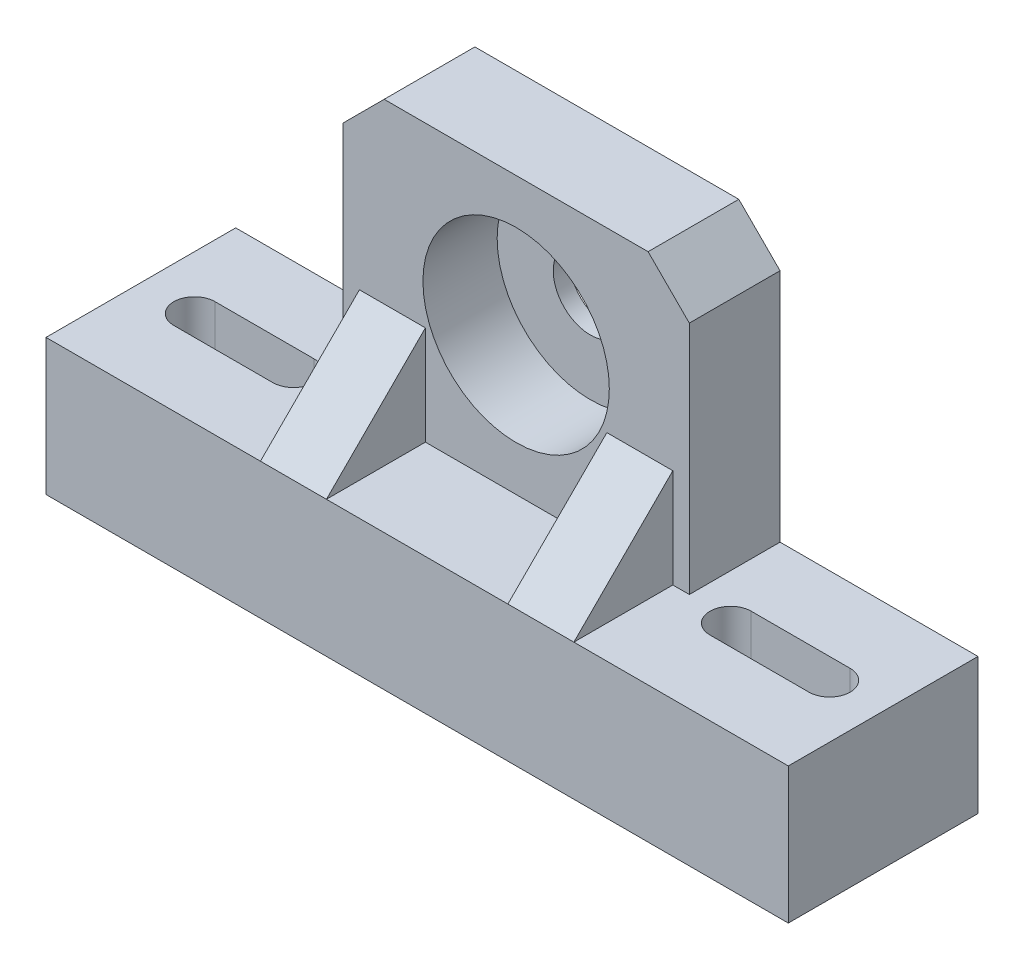
from build123d import *

# Parameters (mm, degrees)
CROQUIS1_W              = 42
CROQUIS1_H              = 33.5
SALIENTE_EXTRUIR1_DEPTH = 5.5
SALIENTE_EXTRUIR2_DEPTH = 12
NERVIO4_REACH           = 72.794
CROQUIS4_WALL_W         = 160.558874412
CROQUIS4_WALL_H         = 8
CROQUIS5_R              = 4.5
CORTAR_EXTRUIR1_DEPTH   = 12
CROQUIS6_R              = 11.3
CORTAR_EXTRUIR2_DEPTH   = 9
CORTAR_EXTRUIR3_DEPTH   = 70.507193872
CHAFL_N1_SIZE           = 5


with BuildPart() as part:
    # Croquis1 → Saliente-Extruir1 (new, symmetric)
    with BuildSketch(Plane.XY):
        Rectangle(CROQUIS1_W, CROQUIS1_H)
        Polygon((21, -16.75), (-21, -16.75), (-45, -16.75), (-45, -33.25), (45, -33.25), (45, -16.75), align=None)
    extrude(amount=SALIENTE_EXTRUIR1_DEPTH, both=True)

    # Croquis2 → Saliente-Extruir2 (add)
    with BuildSketch(Plane.XY.offset(5.5)):
        Polygon((-21, -16.75), (-45, -16.75), (-45, -33.25), (45, -33.25), (45, -16.75), (21, -16.75), align=None)
    extrude(amount=SALIENTE_EXTRUIR2_DEPTH)

    # Croquis4 wall → Nervio4 (add, up to next)
    with BuildSketch(Plane(origin=(15, -10.75, 11.5), x_dir=(0, -0.707106781187, 0.707106781187), z_dir=(0, -0.707106781187, -0.707106781187)), mode=Mode.PRIVATE) as nervio4_sk1:
        Rectangle(CROQUIS4_WALL_W, CROQUIS4_WALL_H)
    nervio4_tool1 = extrude(nervio4_sk1.sketch, amount=NERVIO4_REACH, mode=Mode.PRIVATE) - part.part
    nervio4 = nervio4_tool1.solids().sort_by_distance((15, -10.75, 11.5))[0]
    add(nervio4)

    # Simetría1: Nervio4 across plane
    add(nervio4.mirror(Plane(origin=(0, 0, 0), x_dir=(0, 0, 1), z_dir=(1, 0, 0))))

    # Croquis5 → Cortar-Extruir1 (cut)
    with BuildSketch(Plane.XY.offset(5.5)):
        Circle(CROQUIS5_R)
    extrude(amount=-CORTAR_EXTRUIR1_DEPTH, mode=Mode.SUBTRACT)

    # Croquis6 → Cortar-Extruir2 (cut)
    with BuildSketch(Plane.XY.offset(5.5)):
        Circle(CROQUIS6_R)
    extrude(amount=-CORTAR_EXTRUIR2_DEPTH, mode=Mode.SUBTRACT)

    # Croquis7 → Cortar-Extruir3 (cut, through all)
    with BuildSketch(Plane.XZ.offset(33.25)):
        with BuildLine():
            Line((-38.5, 8.5), (-26.5, 8.5))
            ThreePointArc((-26.5, 8.5), (-24, 6), (-26.5, 3.5))
            Line((-26.5, 3.5), (-38.5, 3.5))
            ThreePointArc((-38.5, 3.5), (-41, 6), (-38.5, 8.5))
        make_face()
        with BuildLine():
            Line((38.5, 8.5), (26.5, 8.5))
            ThreePointArc((26.5, 8.5), (24, 6), (26.5, 3.5))
            Line((26.5, 3.5), (38.5, 3.5))
            ThreePointArc((38.5, 3.5), (41, 6), (38.5, 8.5))
        make_face()
    extrude(amount=-CORTAR_EXTRUIR3_DEPTH, mode=Mode.SUBTRACT)

    # Chaflán1
    chafl_n1_edges = [part.edges().sort_by_distance(p)[0] for p in [
        (-21, 16.75, 0),
        (21, 16.75, 0),
    ]]
    chamfer(chafl_n1_edges, length=CHAFL_N1_SIZE)


solid = part.part
